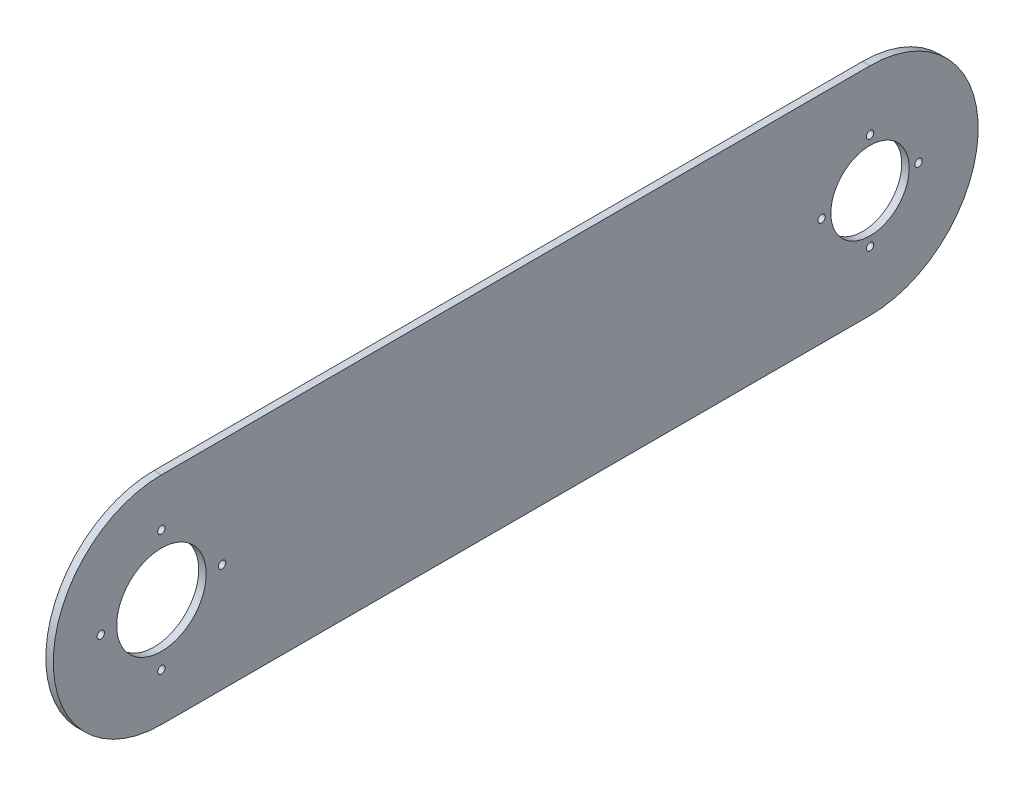
from build123d import *

# Parameters (mm, degrees)
SKETCH1_R           = 24
BOSS_EXTRUDE1_DEPTH = 4
SKETCH4_R           = 2
CUT_EXTRUDE3_DEPTH  = 442.841600576
SKETCH7_R           = 24
SKETCH7_R_2         = 21
BOSS_EXTRUDE3_DEPTH = 4
SKETCH8_R           = 2
CUT_EXTRUDE5_DEPTH  = 442.841600576


with BuildPart() as part:
    # Sketch1 → Boss-Extrude1 (new body)
    with BuildSketch(Plane(origin=(0, 0, 0), x_dir=(0, 0, -1), z_dir=(1, 0, 0))):
        with BuildLine():
            Line((0, 58), (380, 58))
            ThreePointArc((380, 58), (438, 0), (380, -58))
            Line((380, -58), (0, -58))
            ThreePointArc((0, -58), (-58, 0), (0, 58))
        make_face()
        Circle(SKETCH1_R, mode=Mode.SUBTRACT)
        with Locations((380, 0)):
            Circle(SKETCH1_R, mode=Mode.SUBTRACT)
    extrude(amount=BOSS_EXTRUDE1_DEPTH)

    # Sketch4 → Cut-Extrude3 (cut, through all)
    with BuildSketch(Plane.ZY):
        with Locations((0, 32.5)):
            Circle(SKETCH4_R)
        with Locations((32.5, 0)):
            Circle(SKETCH4_R)
        with Locations((0, -32.5)):
            Circle(SKETCH4_R)
        with Locations((-32.5, 0)):
            Circle(SKETCH4_R)
    extrude(amount=-CUT_EXTRUDE3_DEPTH, mode=Mode.SUBTRACT)

    # Sketch7 → Boss-Extrude3 (add)
    with BuildSketch(Plane.ZY):
        with Locations((-380, 0)):
            Circle(SKETCH7_R)
        with Locations((-380, 0)):
            Circle(SKETCH7_R_2, mode=Mode.SUBTRACT)
    extrude(amount=-BOSS_EXTRUDE3_DEPTH)

    # Sketch8 → Cut-Extrude5 (cut, through all)
    with BuildSketch(Plane.ZY):
        with Locations((-380, 26)):
            Circle(SKETCH8_R)
        with Locations((-354, 0)):
            Circle(SKETCH8_R)
        with Locations((-380, -26)):
            Circle(SKETCH8_R)
        with Locations((-406, 0)):
            Circle(SKETCH8_R)
    extrude(amount=-CUT_EXTRUDE5_DEPTH, mode=Mode.SUBTRACT)


solid = part.part
